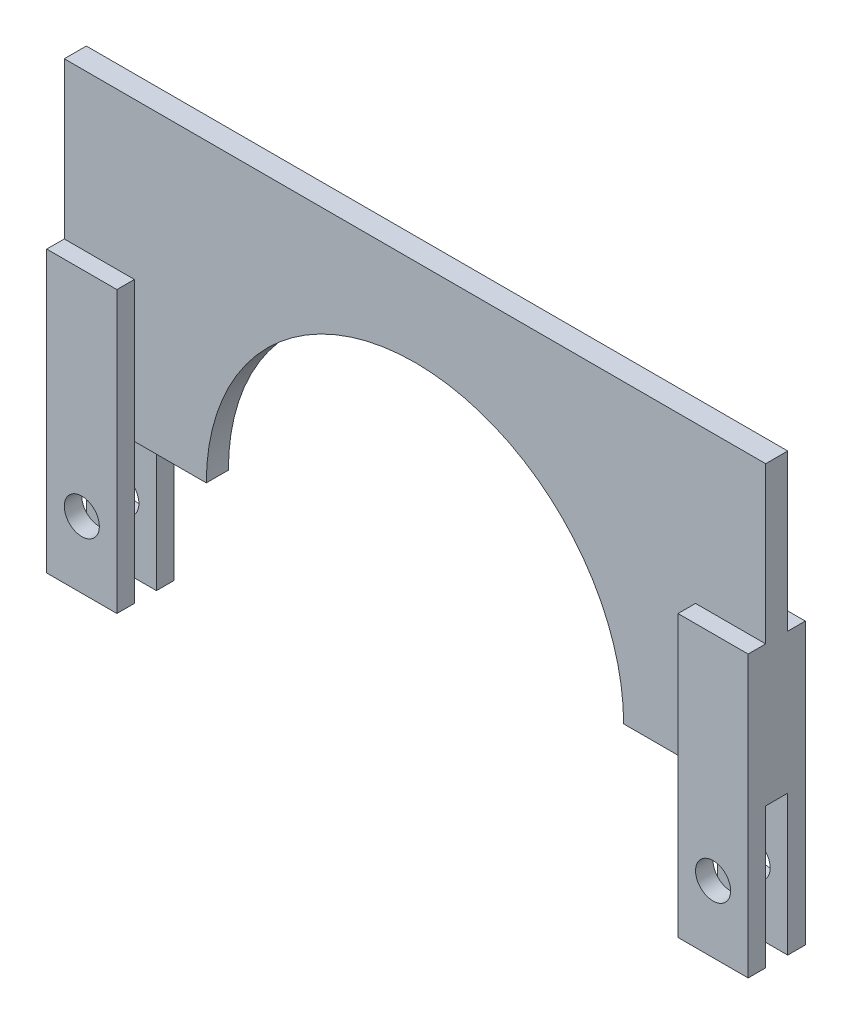
from build123d import *

# Parameters (mm, degrees)
BOSS_EXTRUDE1_DEPTH     = 0.798558565
SKETCH2_W               = 5.08
SKETCH2_H               = 10.16
BOSS_EXTRUDE3_DEPTH     = 1.27
MIRROR2_COPY_1_SKETCH_W = 5.08
MIRROR2_COPY_1_SKETCH_H = 10.16
MIRROR2_COPY_1_DEPTH    = 1.27
SKETCH3_R               = 1.27
CUT_EXTRUDE1_DEPTH      = 34.51023884


with BuildPart() as part:
    # Sketch1 → Boss-Extrude1 (new, symmetric)
    with BuildSketch(Plane.XY):
        with BuildLine():
            Line((-25.4, 0), (-15.113, 0))
            ThreePointArc((-15.113, 0), (0, 15.113), (15.113, 0))
            Line((15.113, 0), (25.4, 0))
            Line((25.4, 0), (25.4, 21.463))
            Line((25.4, 21.463), (-25.4, 21.463))
            Line((-25.4, 21.463), (-25.4, 0))
        make_face()
    extrude(amount=BOSS_EXTRUDE1_DEPTH, both=True)

    # Sketch2 → Boss-Extrude3 (add)
    with BuildSketch(Plane.XY.offset(0.798558565)):
        with Locations((22.86, 5.08)):
            Rectangle(SKETCH2_W, SKETCH2_H)
        with Locations((22.86, -5.08)):
            Rectangle(SKETCH2_W, SKETCH2_H)
    boss_extrude3 = extrude(amount=BOSS_EXTRUDE3_DEPTH)

    # Mirror1: Boss-Extrude3 across plane
    add(boss_extrude3.mirror(Plane.XY))

    # Mirror2: Boss-Extrude3 across plane
    add(boss_extrude3.mirror(Plane(origin=(0, 0, 0), x_dir=(0, 0, 1), z_dir=(1, 0, 0))))

    # Mirror2 copy 1 sketch → Mirror2 copy 1 (add)
    with BuildSketch(Plane(origin=(0, 0, -0.798558565), x_dir=(-1, 0, 0), z_dir=(0, 0, -1))):
        with Locations((22.86, 5.08)):
            Rectangle(MIRROR2_COPY_1_SKETCH_W, MIRROR2_COPY_1_SKETCH_H)
        with Locations((22.86, -5.08)):
            Rectangle(MIRROR2_COPY_1_SKETCH_W, MIRROR2_COPY_1_SKETCH_H)
    extrude(amount=MIRROR2_COPY_1_DEPTH)

    # Sketch3 → Cut-Extrude1 (cut, through all)
    with BuildSketch(Plane(origin=(0, 0, -2.068558565), x_dir=(-1, 0, 0), z_dir=(0, 0, -1))):
        with Locations((-22.86, -5.334)):
            Circle(SKETCH3_R)
    cut_extrude1 = extrude(amount=-CUT_EXTRUDE1_DEPTH, mode=Mode.SUBTRACT)

    # Mirror3: Cut-Extrude1 across plane
    add(cut_extrude1.mirror(Plane(origin=(0, 0, 0), x_dir=(0, 0, 1), z_dir=(1, 0, 0))), mode=Mode.SUBTRACT)


solid = part.part
